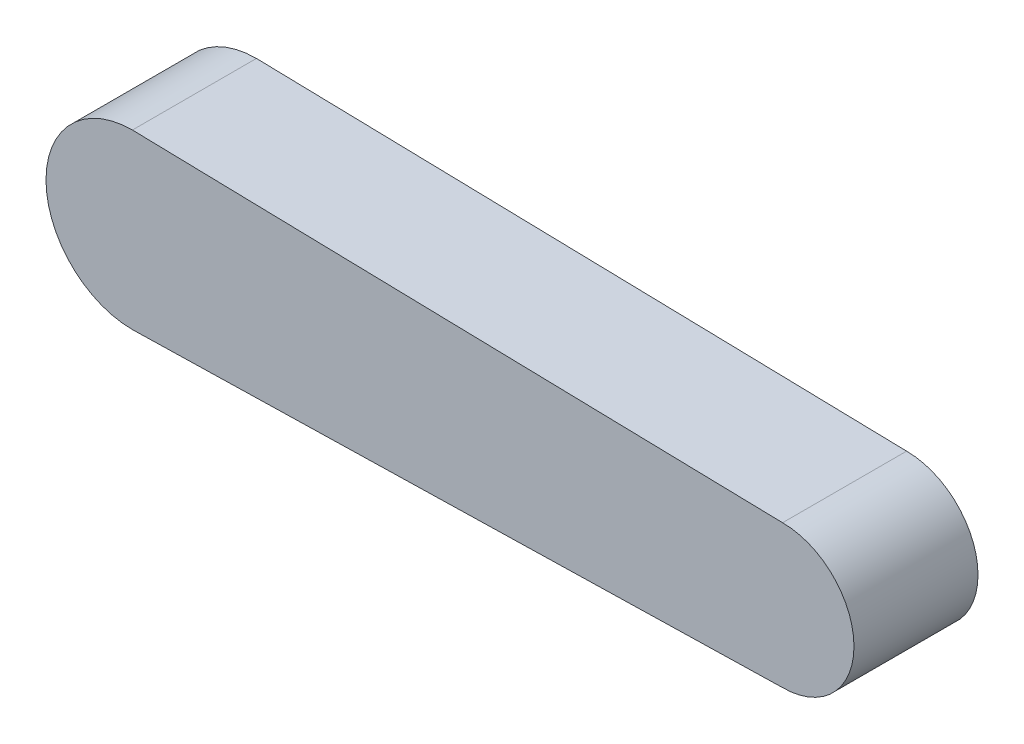
from build123d import *

# Parameters (mm, degrees)
BOSS_EXTRUDE2_DEPTH = 3.3


with BuildPart() as part:
    # Sketch1 → Boss-Extrude2 (new body)
    with BuildSketch(Plane.XY):
        with BuildLine():
            Line((0, 2.3), (17.3, 1.9))
            ThreePointArc((17.3, 1.9), (19.2, 0), (17.3, -1.9))
            Line((17.3, -1.9), (0, -2.3))
            ThreePointArc((0, -2.3), (-2.3, 0), (0, 2.3))
        make_face()
    extrude(amount=BOSS_EXTRUDE2_DEPTH)


solid = part.part
